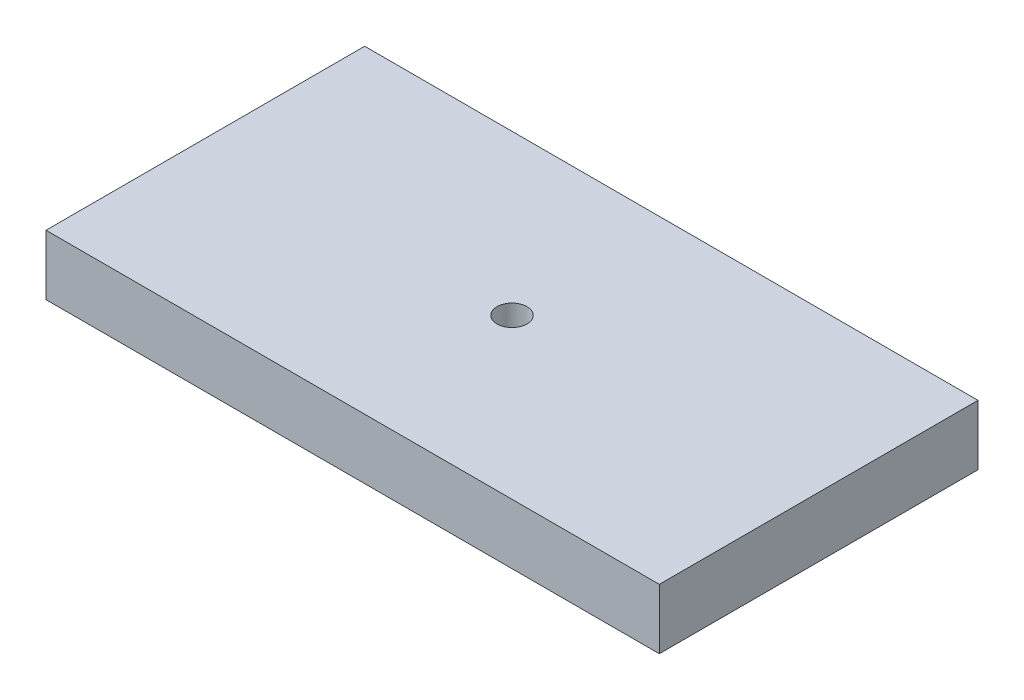
from build123d import *

# Parameters (mm, degrees)
SKETCH1_W           = 102
SKETCH1_H           = 53
BOSS_EXTRUDE1_DEPTH = 10
SKETCH2_R           = 2.5
CUT_EXTRUDE1_DEPTH  = 10


with BuildPart() as part:
    # Sketch1 → Boss-Extrude1 (new body)
    with BuildSketch(Plane(origin=(0, 0, 0), x_dir=(1, 0, 0), z_dir=(0, 1, 0))):
        Rectangle(SKETCH1_W, SKETCH1_H)
    extrude(amount=BOSS_EXTRUDE1_DEPTH)

    # Sketch2 → Cut-Extrude1 (cut)
    with BuildSketch(Plane(origin=(0, 10, 0), x_dir=(1, 0, 0), z_dir=(0, 1, 0))):
        with Locations(Location((0, 0, 0), (0, 0, 270))):
            Circle(SKETCH2_R)
    extrude(amount=-CUT_EXTRUDE1_DEPTH, mode=Mode.SUBTRACT)


solid = part.part
